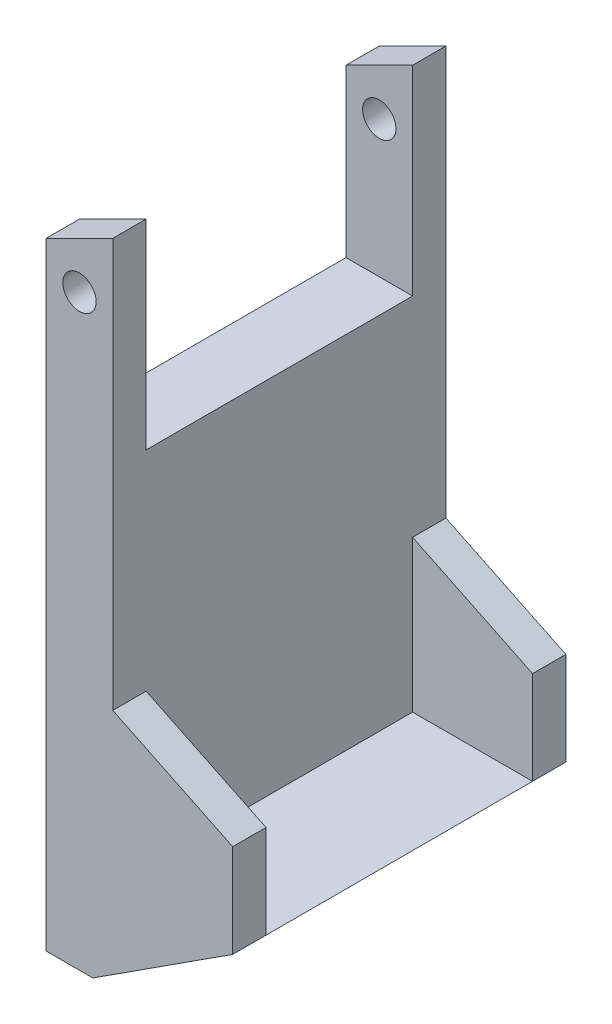
from build123d import *

# Parameters (mm, degrees)
SKETCH_1_W          = 5
SKETCH_1_H          = 10
EXTRUDE_1_DEPTH     = 8
CUT_EXTRUDE_1_DEPTH = 8
EXTRUDE_2_DEPTH     = 5
SKETCH_5_W          = 4
SKETCH_5_H          = 2.5
CUT_EXTRUDE_2_DEPTH = 5
SKETCH_4_W          = 1.118033989
SKETCH_4_H          = 4
CUT_EXTRUDE_3_DEPTH = 5
SKETCH_8_W          = 4
SKETCH_8_H          = 1.4
CUT_EXTRUDE_4_DEPTH = 1.8
SKETCH_10_W         = 1.8
SKETCH_10_H         = 4
CUT_EXTRUDE_5_DEPTH = 2
SKETCH_11_R         = 0.25
CUT_EXTRUDE_6_DEPTH = 10


with BuildPart() as part:
    # 草图1 → 凸台-拉伸1 (new body)
    with BuildSketch(Plane(origin=(0, 0, 0), x_dir=(0, 0, -1), z_dir=(1, 0, 0))):
        Rectangle(SKETCH_1_W, SKETCH_1_H)
    extrude(amount=EXTRUDE_1_DEPTH)

    # 草图2 → 切除-拉伸1 (cut)
    with BuildSketch(Plane.XY.offset(2.5)):
        Polygon((8, 5), (1, 5), (1, -0.636116149), (2.8, -1.507895938), (2.8, -2.907895938), (0.7, -4.264361935), (0, -4.264361935), (0, -5), (8, -5), align=None)
    extrude(amount=-CUT_EXTRUDE_1_DEPTH, mode=Mode.SUBTRACT)

    # 草图3 → 凸台-拉伸2 (add)
    with BuildSketch(Plane.XY.offset(2.5)):
        Polygon((1, 5), (1, 5.5), (0, 5), align=None)
    extrude(amount=-EXTRUDE_2_DEPTH)

    # 草图5 → 切除-拉伸2 (cut)
    with BuildSketch(Plane.ZY):
        with Locations((0, 3.75)):
            Rectangle(SKETCH_5_W, SKETCH_5_H)
    extrude(amount=-CUT_EXTRUDE_2_DEPTH, mode=Mode.SUBTRACT)

    # 草图4 → 切除-拉伸3 (cut)
    with BuildSketch(Plane(origin=(-2, 4, 0), x_dir=(0.8944271909999156, 0.44721359549995865, 0), z_dir=(-0.44721359549995865, 0.8944271909999156, 0))):
        with Locations((2.795084972, 0)):
            Rectangle(SKETCH_4_W, SKETCH_4_H)
    extrude(amount=-CUT_EXTRUDE_3_DEPTH, mode=Mode.SUBTRACT)

    # 草图8 → 切除-拉伸4 (cut)
    with BuildSketch(Plane(origin=(2.8, 0, 0), x_dir=(0, 0, -1), z_dir=(1, 0, 0))):
        with Locations((0, -2.207895938)):
            Rectangle(SKETCH_8_W, SKETCH_8_H)
    extrude(amount=-CUT_EXTRUDE_4_DEPTH, mode=Mode.SUBTRACT)

    # 草图10 → 切除-拉伸5 (cut)
    with BuildSketch(Plane.XZ.offset(1.507895938)):
        with Locations((1.9, 0)):
            Rectangle(SKETCH_10_W, SKETCH_10_H)
    extrude(amount=-CUT_EXTRUDE_5_DEPTH, mode=Mode.SUBTRACT)

    # 草图11 → 切除-拉伸6 (cut)
    with BuildSketch(Plane(origin=(0, 0, -2.5), x_dir=(-1, 0, 0), z_dir=(0, 0, -1))):
        with Locations((-0.5, 4.55)):
            Circle(SKETCH_11_R)
    extrude(amount=-CUT_EXTRUDE_6_DEPTH, mode=Mode.SUBTRACT)


solid = part.part
